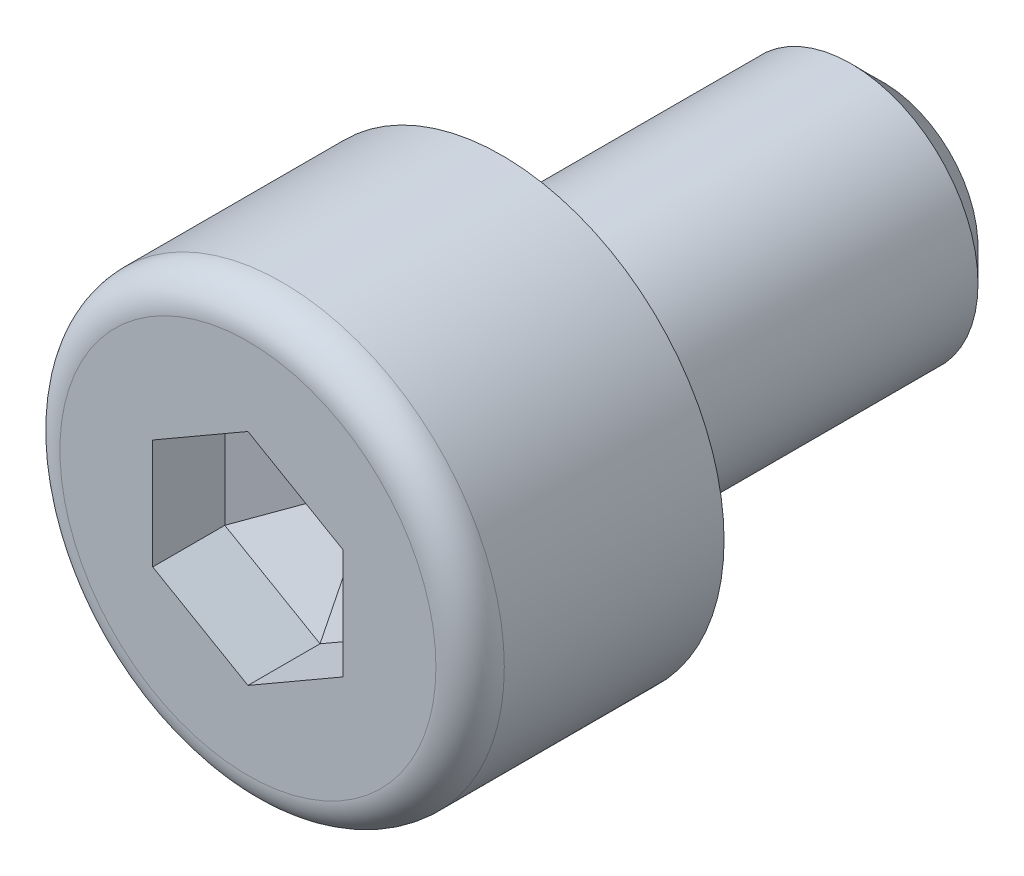
from build123d import *
from OCP.BRepFilletAPI import BRepFilletAPI_MakeChamfer

# Parameters (mm, degrees)
SKETCH_1_R          = 3.5
EXTRUDE_1_DEPTH     = 4
CUT_EXTRUDE_1_DEPTH = 2
SKETCH_3_R          = 2
EXTRUDE_2_DEPTH     = 6
CHAMFER_1_SIZE      = 0.5
FILLET_1_R          = 0.538461538
CHAMFER_2_SIZE      = 0.864553314
CHAMFER_2_SIZE2     = 1.497450266
FILLET_2_R          = 0.1


with BuildPart() as part:
    # 草图1 → 凸台-拉伸1 (new body)
    with BuildSketch(Plane.XY):
        Circle(SKETCH_1_R)
    extrude(amount=EXTRUDE_1_DEPTH)

    # 草图2 → 切除-拉伸1 (cut)
    with BuildSketch(Plane.XY.offset(4)):
        Polygon((1.5, 0.866025404), (0, 1.732050808), (-1.5, 0.866025404), (-1.5, -0.866025404), (0, -1.732050808), (1.5, -0.866025404), align=None)
    extrude(amount=-CUT_EXTRUDE_1_DEPTH, mode=Mode.SUBTRACT)

    # 草图3 → 凸台-拉伸2 (add)
    with BuildSketch(Plane(origin=(0, 0, 0), x_dir=(-1, 0, 0), z_dir=(0, 0, -1))):
        Circle(SKETCH_3_R)
    extrude(amount=EXTRUDE_2_DEPTH)

    # 倒角1
    chamfer_1_edges = [part.edges().sort_by_distance(p)[0] for p in [
        (2, 0, -6),
    ]]
    chamfer(chamfer_1_edges, length=CHAMFER_1_SIZE)

    # 圆角1
    fillet_1_edges = [part.edges().sort_by_distance(p)[0] for p in [
        (-3.5, 0, 4),
    ]]
    fillet(fillet_1_edges, radius=FILLET_1_R)

    # 倒角2: one chamfer whose edges measure the first distance from different faces: ONE call of the kernel's chamfer builder (chamfer() names one face for all edges)
    chamfer_2_edges_1 = [part.edges().sort_by_distance(p)[0] for p in [
        (-1.5, 0, 2),
    ]]
    chamfer_2_side_1 = [part.faces().sort_by_distance(p)[0] for p in [
        (-1.5, 0, 3),
    ]]
    chamfer_2_edges_2 = [part.edges().sort_by_distance(p)[0] for p in [
        (-0.75, 1.299038106, 2),
    ]]
    chamfer_2_side_2 = [part.faces().sort_by_distance(p)[0] for p in [
        (-0.75, 1.299038106, 3),
    ]]
    chamfer_2_edges_3 = [part.edges().sort_by_distance(p)[0] for p in [
        (0.75, 1.299038106, 2),
    ]]
    chamfer_2_side_3 = [part.faces().sort_by_distance(p)[0] for p in [
        (0.75, 1.299038106, 3),
    ]]
    chamfer_2_edges_4 = [part.edges().sort_by_distance(p)[0] for p in [
        (1.5, 0, 2),
    ]]
    chamfer_2_side_4 = [part.faces().sort_by_distance(p)[0] for p in [
        (1.5, 0, 3),
    ]]
    chamfer_2_edges_5 = [part.edges().sort_by_distance(p)[0] for p in [
        (-0.75, -1.299038106, 2),
    ]]
    chamfer_2_side_5 = [part.faces().sort_by_distance(p)[0] for p in [
        (-0.75, -1.299038106, 3),
    ]]
    chamfer_2_edges_6 = [part.edges().sort_by_distance(p)[0] for p in [
        (0.75, -1.299038106, 2),
    ]]
    chamfer_2_side_6 = [part.faces().sort_by_distance(p)[0] for p in [
        (0.75, -1.299038106, 3),
    ]]
    chamfer_2 = BRepFilletAPI_MakeChamfer(part.part.solid().wrapped)
    for e in chamfer_2_edges_1:
        chamfer_2.Add(CHAMFER_2_SIZE, CHAMFER_2_SIZE2, e.wrapped, chamfer_2_side_1[0].wrapped)  # the first distance lies on this face
    for e in chamfer_2_edges_2:
        chamfer_2.Add(CHAMFER_2_SIZE, CHAMFER_2_SIZE2, e.wrapped, chamfer_2_side_2[0].wrapped)  # the first distance lies on this face
    for e in chamfer_2_edges_3:
        chamfer_2.Add(CHAMFER_2_SIZE, CHAMFER_2_SIZE2, e.wrapped, chamfer_2_side_3[0].wrapped)  # the first distance lies on this face
    for e in chamfer_2_edges_4:
        chamfer_2.Add(CHAMFER_2_SIZE, CHAMFER_2_SIZE2, e.wrapped, chamfer_2_side_4[0].wrapped)  # the first distance lies on this face
    for e in chamfer_2_edges_5:
        chamfer_2.Add(CHAMFER_2_SIZE, CHAMFER_2_SIZE2, e.wrapped, chamfer_2_side_5[0].wrapped)  # the first distance lies on this face
    for e in chamfer_2_edges_6:
        chamfer_2.Add(CHAMFER_2_SIZE, CHAMFER_2_SIZE2, e.wrapped, chamfer_2_side_6[0].wrapped)  # the first distance lies on this face
    add(Compound.cast(chamfer_2.Shape()), mode=Mode.REPLACE)

    # 圆角2
    fillet_2_edges = [part.edges().sort_by_distance(p)[0] for p in [
        (2, 0, 0),
    ]]
    fillet(fillet_2_edges, radius=FILLET_2_R)


solid = part.part
